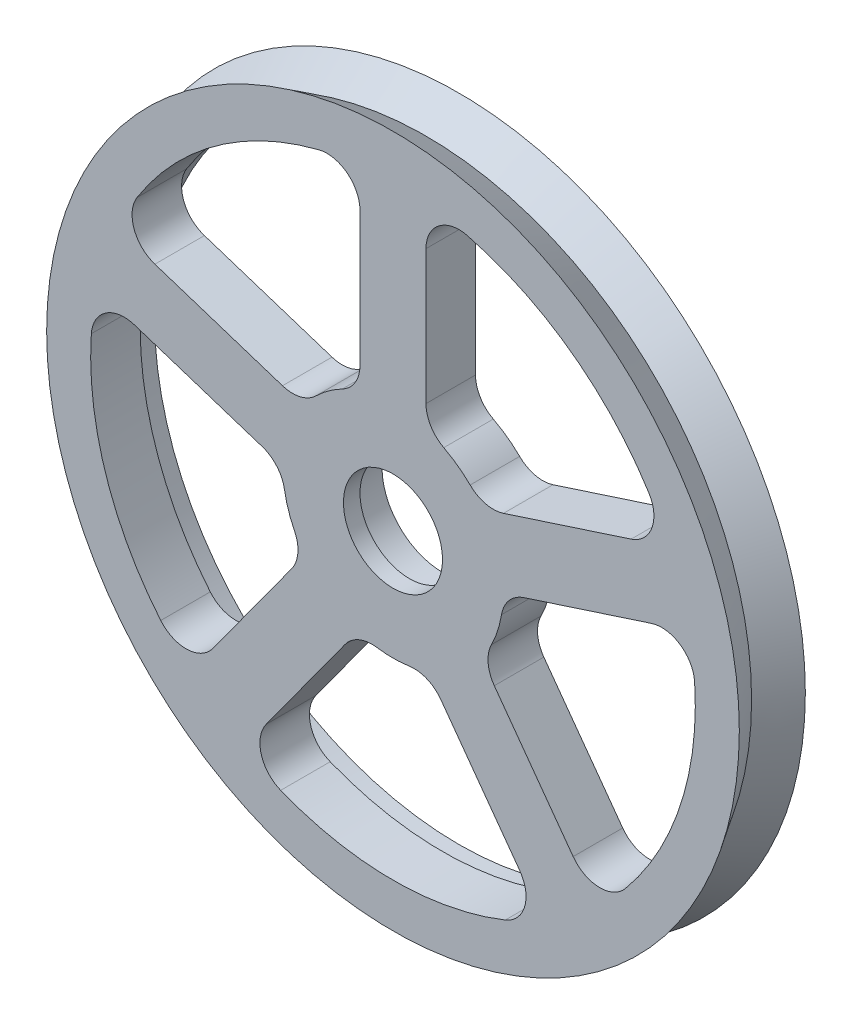
from build123d import *

# Parameters (mm, degrees)
CUT_EXTRUDE1_DEPTH      = 5
SKETCH3_R               = 27.671687605
CUT_EXTRUDE2_DEPTH      = 1.5
FILLET1_R               = 3
CUT_EXTRUDE3_DEPTH      = 11
CUT_EXTRUDE3_DEPTH_BACK = 1.5
SKETCH4_R               = 5.5


with BuildPart() as part:
    # Sketch1 → Revolve1 (revolve)
    with BuildSketch(Plane(origin=(0, 0, 0), x_dir=(0, 0, -1), z_dir=(1, 0, 0)), mode=Mode.PRIVATE) as revolve1_sk:
        Polygon((3, 31.471687605), (3, 4.5), (-3, 4.5), (-3, 31.471687605), (0, 29.587241701), align=None)
    revolve(revolve1_sk.sketch.rotate(Axis((0, 0, 0), (0, 0, -1)), 90), axis=Axis((0, 0, 0), (0, 0, -1)))

    # Sketch2 → Cut-Extrude1 (cut, symmetric)
    with BuildSketch(Plane.XY):
        with BuildLine():
            Line((-3, 27.307391304), (-3, 9.539392014))
            ThreePointArc((-3, 9.539392014), (-5.877852523, 8.090169944), (-8.145449953, 5.801003797))
            Line((-8.145449953, 5.801003797), (-25.04382146, 11.291617534))
            ThreePointArc((-25.04382146, 11.291617534), (-16.14745283, 22.225062136), (-3, 27.307391304))
        make_face()
        with BuildLine():
            Line((3, 27.307391304), (3, 9.539392014))
            ThreePointArc((3, 9.539392014), (5.877852523, 8.090169944), (8.145449953, 5.801003797))
            Line((8.145449953, 5.801003797), (25.04382146, 11.291617534))
            ThreePointArc((25.04382146, 11.291617534), (16.14745283, 22.225062136), (3, 27.307391304))
        make_face()
        with BuildLine():
            Line((26.897923426, 5.585278436), (9.99955192, 0.094664699))
            ThreePointArc((9.99955192, 0.094664699), (9.510565163, -3.090169944), (8.034164925, -5.954174499))
            Line((8.034164925, -5.954174499), (18.47793287, -20.328787881))
            ThreePointArc((18.47793287, -20.328787881), (26.12712751, -8.489218334), (26.897923426, 5.585278436))
        make_face()
        with BuildLine():
            Line((13.623830904, -23.855499394), (3.180062959, -9.480886012))
            ThreePointArc((3.180062959, -9.480886012), (0, -10), (-3.180062959, -9.480886012))
            Line((-3.180062959, -9.480886012), (-13.623830904, -23.855499394))
            ThreePointArc((-13.623830904, -23.855499394), (0, -27.471687605), (13.623830904, -23.855499394))
        make_face()
        with BuildLine():
            Line((-18.47793287, -20.328787881), (-8.034164925, -5.954174499))
            ThreePointArc((-8.034164925, -5.954174499), (-9.510565163, -3.090169944), (-9.99955192, 0.094664699))
            Line((-9.99955192, 0.094664699), (-26.897923426, 5.585278436))
            ThreePointArc((-26.897923426, 5.585278436), (-26.12712751, -8.489218334), (-18.47793287, -20.328787881))
        make_face()
    extrude(amount=CUT_EXTRUDE1_DEPTH, both=True, mode=Mode.SUBTRACT)

    # Sketch3 → Cut-Extrude2 (cut)
    with BuildSketch(Plane(origin=(0, 0, -3), x_dir=(-1, 0, 0), z_dir=(0, 0, -1))):
        Circle(SKETCH3_R)
    extrude(amount=-CUT_EXTRUDE2_DEPTH, mode=Mode.SUBTRACT)

    # Fillet1
    fillet1_edges = [part.edges().sort_by_distance(p)[0] for p in [
        (-8.034164925, -5.954174499, 0.75),
        (-18.47793287, -20.328787881, 0.75),
        (-9.99955192, 0.094664699, 0.75),
        (-26.897923426, 5.585278436, 0.75),
        (3.180062959, -9.480886012, 0.75),
        (13.623830904, -23.855499394, 0.75),
        (-3.180062959, -9.480886012, 0.75),
        (-13.623830904, -23.855499394, 0.75),
        (9.99955192, 0.094664699, 0.75),
        (26.897923426, 5.585278436, 0.75),
        (8.034164925, -5.954174499, 0.75),
        (18.47793287, -20.328787881, 0.75),
        (3, 9.539392014, 0.75),
        (3, 27.307391304, 0.75),
        (8.145449953, 5.801003797, 0.75),
        (25.04382146, 11.291617534, 0.75),
        (-8.145449953, 5.801003797, 0.75),
        (-25.04382146, 11.291617534, 0.75),
        (-3, 9.539392014, 0.75),
        (-3, 27.307391304, 0.75),
    ]]
    fillet(fillet1_edges, radius=FILLET1_R)

    # Sketch4 → Cut-Extrude3 (cut, two sides: drawn at the far end of the back side and taken through both)
    with BuildSketch(Plane(origin=(0, 0, 0), x_dir=(-1, 0, 0), z_dir=(0, 0, -1)).offset(-CUT_EXTRUDE3_DEPTH_BACK)):
        Circle(SKETCH4_R)
    extrude(amount=CUT_EXTRUDE3_DEPTH + CUT_EXTRUDE3_DEPTH_BACK, mode=Mode.SUBTRACT)


solid = part.part
